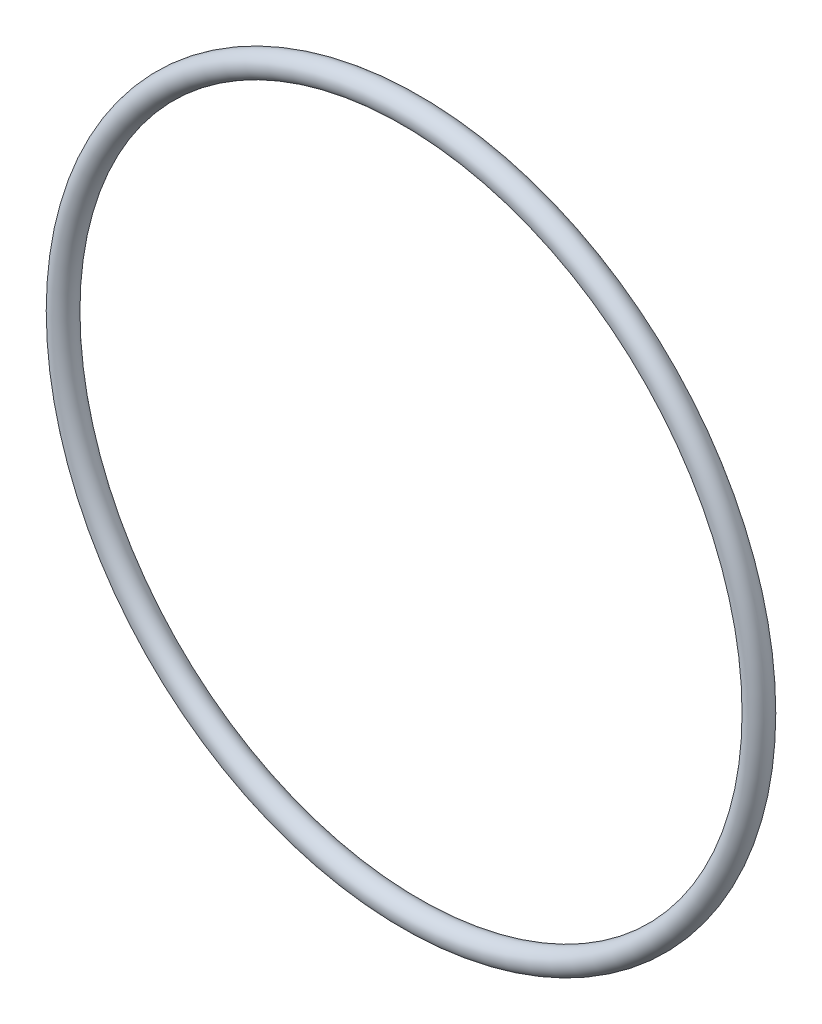
from build123d import *

# Parameters (mm, degrees)
SWEEP1_PROFILE_R = 1.524


with BuildPart() as part:
    # Sweep1: sweep along a path in Sketch1
    with BuildLine(Plane.XY) as sweep1_path:
        CenterArc((0, 0), 44.45, 0, 360)
    # Sweep1 profile (on start of the path) → Sweep1 (sweep)
    with BuildSketch(Plane(origin=(44.45, 0, 0), x_dir=(0, 0, 1), z_dir=(0, 1, 0))):
        Circle(SWEEP1_PROFILE_R)
    sweep(path=sweep1_path.line)


solid = part.part
